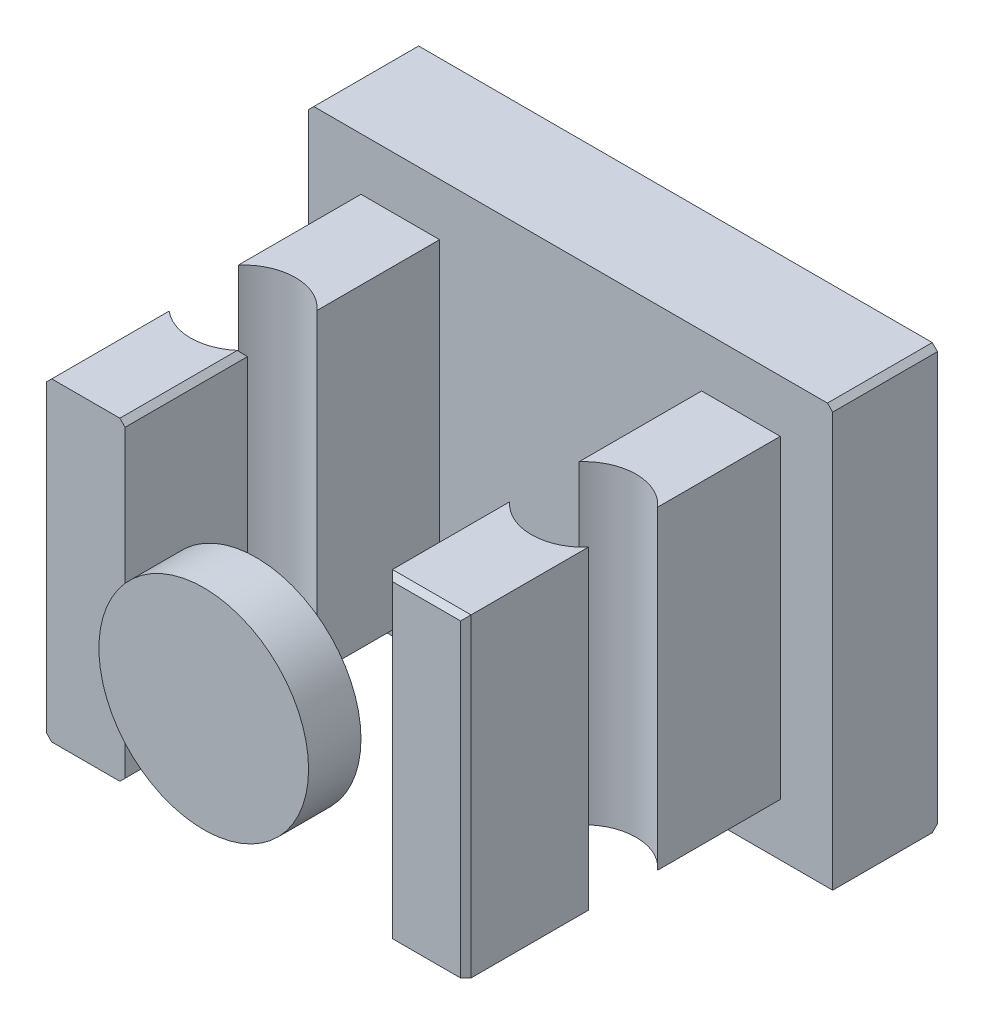
from build123d import *

# Parameters (mm, degrees)
SKETCH1_W               = 100
SKETCH1_H               = 80
BOSS_EXTRUDE1_DEPTH     = 20
SKETCH2_W               = 15
SKETCH2_H               = 60
BOSS_EXTRUDE2_DEPTH     = 60
CUT_EXTRUDE1_DEPTH      = 100
CUT_EXTRUDE1_DEPTH_BACK = 100
SKETCH3_R               = 10
SKETCH4_R               = 20
BOSS_EXTRUDE3_DEPTH     = 10
CHAMFER1_SIZE           = 1
CHAMFER2_SIZE           = 1
CHAMFER3_SIZE           = 1


with BuildPart() as part:
    # Sketch1 → Boss-Extrude1 (new body)
    with BuildSketch(Plane.XY):
        Rectangle(SKETCH1_W, SKETCH1_H)
    extrude(amount=BOSS_EXTRUDE1_DEPTH)

    # Sketch2 → Boss-Extrude2 (add)
    with BuildSketch(Plane.XY.offset(20)):
        with Locations((-32.5, 0)):
            Rectangle(SKETCH2_W, SKETCH2_H)
        with Locations((32.5, 0)):
            Rectangle(SKETCH2_W, SKETCH2_H)
    extrude(amount=BOSS_EXTRUDE2_DEPTH)

    # Sketch3 → Cut-Extrude1 (cut, two sides: drawn at the far end of the back side and taken through both)
    with BuildSketch(Plane(origin=(0, 0, 0), x_dir=(1, 0, 0), z_dir=(0, 1, 0)).offset(-CUT_EXTRUDE1_DEPTH_BACK)):
        with Locations((-32.5, -50)):
            Circle(SKETCH3_R)
        with Locations((32.5, -50)):
            Circle(SKETCH3_R)
    extrude(amount=CUT_EXTRUDE1_DEPTH + CUT_EXTRUDE1_DEPTH_BACK, mode=Mode.SUBTRACT)


with BuildPart() as cut_extrude1_piece_1:
    # of the separate pieces the step leaves, piece 1, a body of its own (cut_extrude1_pieces)
    add(part.part.solids().sort_by_distance((-50, -40, 0))[0])

    # Chamfer1
    chamfer1_edges = [cut_extrude1_piece_1.edges().sort_by_distance(p)[0] for p in [
        (0, -40, 0),
        (-50, -40, 10),
        (-50, 40, 10),
        (50, 40, 10),
    ]]
    chamfer(chamfer1_edges, length=CHAMFER1_SIZE)


with BuildPart() as cut_extrude1_piece_2:
    # of the separate pieces the step leaves, piece 2, a body of its own (cut_extrude1_pieces)
    add(part.part.solids().sort_by_distance((-40, -30, 56.614378278))[0])

    # Chamfer2
    chamfer2_edges = [cut_extrude1_piece_2.edges().sort_by_distance(p)[0] for p in [
        (-40, -30, 68.307189139),
        (-25, -30, 68.307189139),
        (-25, 30, 68.307189139),
        (-40, 30, 68.307189139),
    ]]
    chamfer(chamfer2_edges, length=CHAMFER2_SIZE)


with BuildPart() as cut_extrude1_piece_3:
    # of the separate pieces the step leaves, piece 3, a body of its own (cut_extrude1_pieces)
    add(part.part.solids().sort_by_distance((25, -30, 56.614378278))[0])

    # Chamfer3
    chamfer3_edges = [cut_extrude1_piece_3.edges().sort_by_distance(p)[0] for p in [
        (25, 0, 80),
        (40, 0, 80),
        (32.5, 30, 80),
    ]]
    chamfer(chamfer3_edges, length=CHAMFER3_SIZE)


with BuildPart() as body_4:
    # Sketch4 → Boss-Extrude3 (new body)
    with BuildSketch(Plane.XY.offset(80)):
        Circle(SKETCH4_R)
    extrude(amount=BOSS_EXTRUDE3_DEPTH)


solid = Compound([cut_extrude1_piece_1.part, cut_extrude1_piece_2.part, cut_extrude1_piece_3.part, body_4.part])
